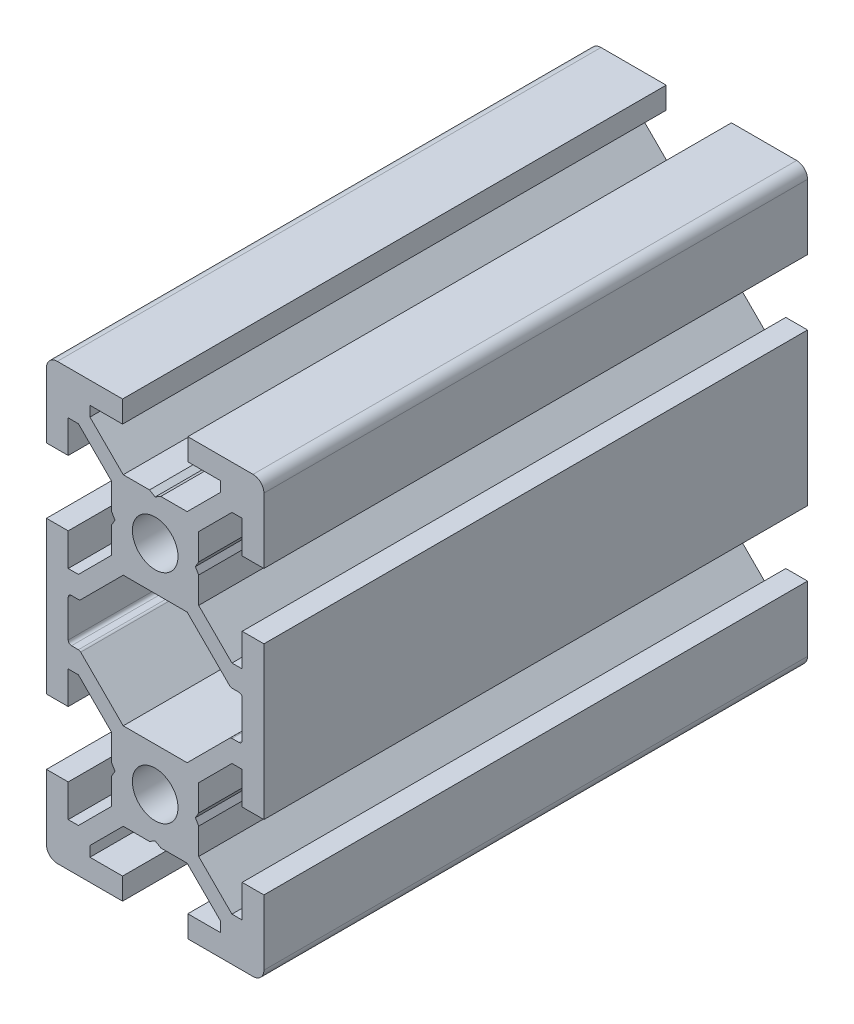
from build123d import *

# Parameters (mm, degrees)
SKETCH1_R           = 2.1
BOSS_EXTRUDE1_DEPTH = 50


with BuildPart() as part:
    # Sketch1 → Boss-Extrude1 (new body)
    with BuildSketch(Plane.XY):
        with BuildLine():
            Line((-8, -16), (-8, -13))
            Line((-8, -13), (-10, -13))
            Line((-10, -13), (-10, -19))
            ThreePointArc((-10, -19), (-9.707106781, -19.707106781), (-9, -20))
            Line((-9, -20), (-3, -20))
            Line((-3, -20), (-3, -18))
            Line((-3, -18), (-6, -18))
            Line((-6, -18), (-6, -17.060660172))
            Line((-6, -17.060660172), (-2.939339828, -14))
            Line((-2.939339828, -14), (-0.519615242, -14))
            Line((-0.519615242, -14), (0, -13.7))
            Line((0, -13.7), (0.519615242, -14))
            Line((0.519615242, -14), (2.939339828, -14))
            Line((2.939339828, -14), (6, -17.060660172))
            Line((6, -17.060660172), (6, -18))
            Line((6, -18), (3, -18))
            Line((3, -18), (3, -20))
            Line((3, -20), (9, -20))
            ThreePointArc((9, -20), (9.707106781, -19.707106781), (10, -19))
            Line((10, -19), (10, -13))
            Line((10, -13), (8, -13))
            Line((8, -13), (8, -16))
            Line((8, -16), (7.060660172, -16))
            Line((7.060660172, -16), (4, -12.939339828))
            Line((4, -12.939339828), (4, -10.519615242))
            Line((4, -10.519615242), (3.7, -10))
            Line((3.7, -10), (4, -9.480384758))
            Line((4, -9.480384758), (4, -7.060660172))
            Line((4, -7.060660172), (7.060660172, -4))
            Line((7.060660172, -4), (8, -4))
            Line((8, -4), (8, -7))
            Line((8, -7), (10, -7))
            Line((10, -7), (10, 7))
            Line((10, 7), (8, 7))
            Line((8, 7), (8, 4))
            Line((8, 4), (7.060660172, 4))
            Line((7.060660172, 4), (4, 7.060660172))
            Line((4, 7.060660172), (4, 9.480384758))
            Line((4, 9.480384758), (3.7, 10))
            Line((3.7, 10), (4, 10.519615242))
            Line((4, 10.519615242), (4, 12.939339828))
            Line((4, 12.939339828), (7.060660172, 16))
            Line((7.060660172, 16), (8, 16))
            Line((8, 16), (8, 13))
            Line((8, 13), (10, 13))
            Line((10, 13), (10, 19))
            ThreePointArc((10, 19), (9.707106781, 19.707106781), (9, 20))
            Line((9, 20), (3, 20))
            Line((3, 20), (3, 18))
            Line((3, 18), (6, 18))
            Line((6, 18), (6, 17.060660172))
            Line((6, 17.060660172), (2.939339828, 14))
            Line((2.939339828, 14), (0.519615242, 14))
            Line((0.519615242, 14), (0, 13.7))
            Line((0, 13.7), (-0.519615242, 14))
            Line((-0.519615242, 14), (-2.939339828, 14))
            Line((-2.939339828, 14), (-6, 17.060660172))
            Line((-6, 17.060660172), (-6, 18))
            Line((-6, 18), (-3, 18))
            Line((-3, 18), (-3, 20))
            Line((-3, 20), (-9, 20))
            ThreePointArc((-9, 20), (-9.707106781, 19.707106781), (-10, 19))
            Line((-10, 19), (-10, 13))
            Line((-10, 13), (-8, 13))
            Line((-8, 13), (-8, 16))
            Line((-8, 16), (-7.060660172, 16))
            Line((-7.060660172, 16), (-4, 12.939339828))
            Line((-4, 12.939339828), (-4, 10.519615242))
            Line((-4, 10.519615242), (-3.7, 10))
            Line((-3.7, 10), (-4, 9.480384758))
            Line((-4, 9.480384758), (-4, 7.060660172))
            Line((-4, 7.060660172), (-7.060660172, 4))
            Line((-7.060660172, 4), (-8, 4))
            Line((-8, 4), (-8, 7))
            Line((-8, 7), (-10, 7))
            Line((-10, 7), (-10, -7))
            Line((-10, -7), (-8, -7))
            Line((-8, -7), (-8, -4))
            Line((-8, -4), (-7.060660172, -4))
            Line((-7.060660172, -4), (-4, -7.060660172))
            Line((-4, -7.060660172), (-4, -9.480384758))
            Line((-4, -9.480384758), (-3.7, -10))
            Line((-3.7, -10), (-4, -10.519615242))
            Line((-4, -10.519615242), (-4, -12.939339828))
            Line((-4, -12.939339828), (-7.060660172, -16))
            Line((-7.060660172, -16), (-8, -16))
        make_face()
        with Locations(Location((0, -10, 0), (0, 0, 180))):
            Circle(SKETCH1_R, mode=Mode.SUBTRACT)
        with Locations(Location((0, 10, 0), (0, 0, 180))):
            Circle(SKETCH1_R, mode=Mode.SUBTRACT)
        with BuildLine():
            Line((-7.063603897, -2), (-7.7, -2))
            ThreePointArc((-7.7, -2), (-7.912132034, -1.912132034), (-8, -1.7))
            Line((-8, -1.7), (-8, 1.7))
            ThreePointArc((-8, 1.7), (-7.912132034, 1.912132034), (-7.7, 2))
            Line((-7.7, 2), (-7.063603897, 2))
            ThreePointArc((-7.063603897, 2), (-6.948798867, 2.02283614), (-6.851471863, 2.087867966))
            Line((-6.851471863, 2.087867966), (-2.939339828, 6))
            Line((-2.939339828, 6), (2.939339828, 6))
            Line((2.939339828, 6), (6.851471863, 2.087867966))
            ThreePointArc((6.851471863, 2.087867966), (6.948798867, 2.02283614), (7.063603897, 2))
            Line((7.063603897, 2), (7.7, 2))
            ThreePointArc((7.7, 2), (7.912132034, 1.912132034), (8, 1.7))
            Line((8, 1.7), (8, -1.7))
            ThreePointArc((8, -1.7), (7.912132034, -1.912132034), (7.7, -2))
            Line((7.7, -2), (7.063603897, -2))
            ThreePointArc((7.063603897, -2), (6.948798867, -2.02283614), (6.851471863, -2.087867966))
            Line((6.851471863, -2.087867966), (2.939339828, -6))
            Line((2.939339828, -6), (-2.939339828, -6))
            Line((-2.939339828, -6), (-6.851471863, -2.087867966))
            ThreePointArc((-6.851471863, -2.087867966), (-6.948798867, -2.02283614), (-7.063603897, -2))
        make_face(mode=Mode.SUBTRACT)
    extrude(amount=-BOSS_EXTRUDE1_DEPTH)


solid = part.part
